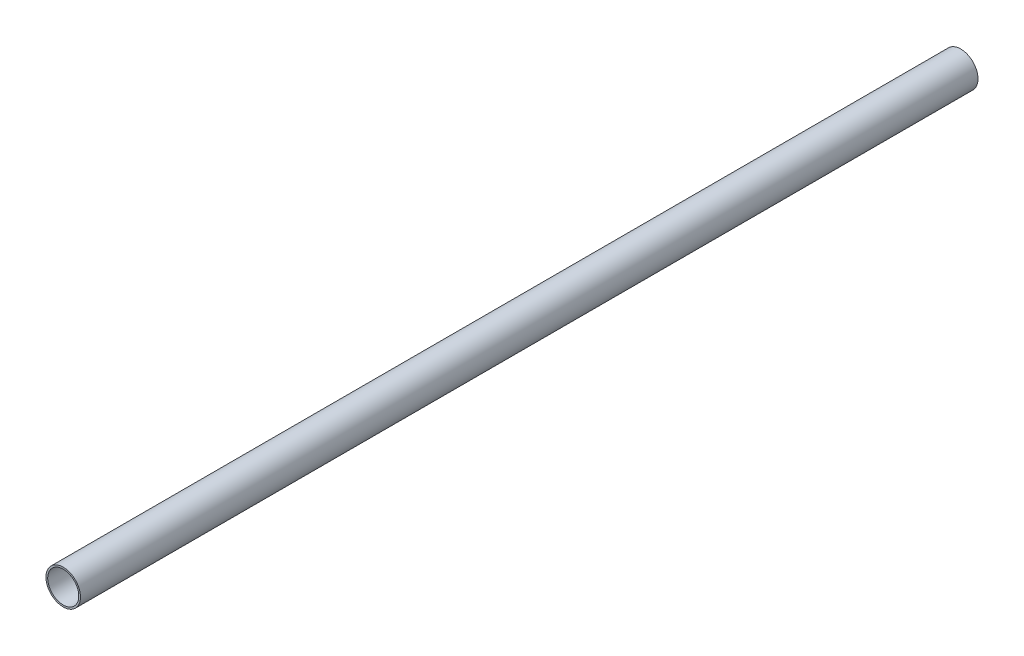
from build123d import *

# Parameters (mm, degrees)
SKETCH1_R           = 10
SKETCH1_R_2         = 9
BOSS_EXTRUDE1_DEPTH = 520


with BuildPart() as part:
    # Sketch1 → Boss-Extrude1 (new body)
    with BuildSketch(Plane.XY):
        Circle(SKETCH1_R)
        Circle(SKETCH1_R_2, mode=Mode.SUBTRACT)
    extrude(amount=BOSS_EXTRUDE1_DEPTH)


solid = part.part
